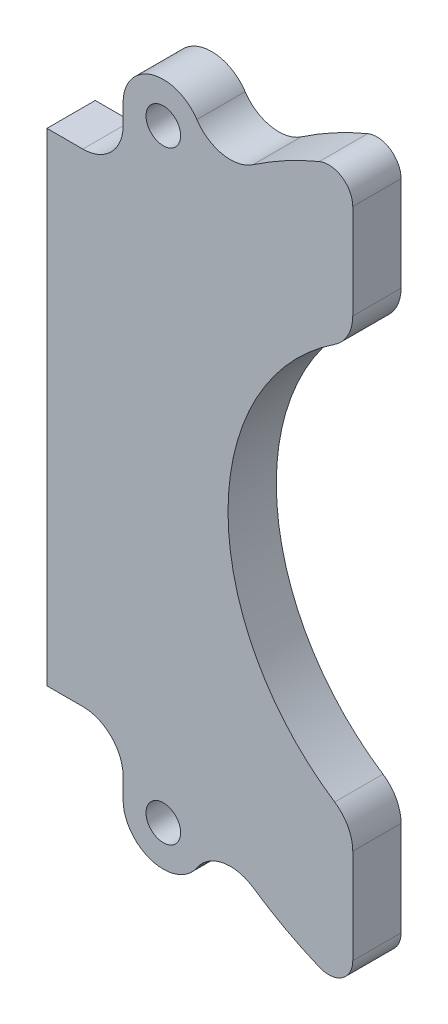
from build123d import *

# Parameters (mm, degrees)
SKETCH_1_R          = 2.15
EXTRUDE_1_DEPTH     = 6
CUT_EXTRUDE_START   = -10
CUT_EXTRUDE_1_DEPTH = 10
FILLET_1_R          = 5
FILLET_2_R          = 3


with BuildPart() as part:
    # 草图1 → 凸台-拉伸1 (new body)
    with BuildSketch(Plane.XY):
        with BuildLine():
            Line((-52, 30), (-52, 8.75))
            Line((-52, 8.75), (-52, -8.75))
            Line((-52, -8.75), (-52, -30))
            Line((-52, -30), (-47.54, -30))
            ThreePointArc((-47.54, -30), (-44.004466094, -31.464466094), (-42.54, -35))
            Line((-42.54, -35), (-42.54, -37.5))
            ThreePointArc((-42.54, -37.5), (-38.982425028, -42.287422066), (-33.372235985, -40.262198963))
            ThreePointArc((-33.372235985, -40.262198963), (-30.171244586, -38.118753147), (-26.396349665, -38.887436588))
            ThreePointArc((-26.396349665, -38.887436588), (0, -47), (26.396349665, -38.887436588))
            ThreePointArc((26.396349665, -38.887436588), (30.171244586, -38.118753147), (33.372235985, -40.262198963))
            ThreePointArc((33.372235985, -40.262198963), (38.674773042, -42.369526686), (42.499484755, -38.135225128))
            Line((42.499484755, -38.135225128), (46.619156699, -5.971116201))
            ThreePointArc((46.619156699, -5.971116201), (47, 0), (46.619156699, 5.971116201))
            Line((46.619156699, 5.971116201), (42.499484755, 38.135225128))
            ThreePointArc((42.499484755, 38.135225128), (38.674773042, 42.369526686), (33.372235985, 40.262198963))
            ThreePointArc((33.372235985, 40.262198963), (30.171244586, 38.118753147), (26.396349665, 38.887436588))
            ThreePointArc((26.396349665, 38.887436588), (0, 47), (-26.396349665, 38.887436588))
            ThreePointArc((-26.396349665, 38.887436588), (-30.171244586, 38.118753147), (-33.372235985, 40.262198963))
            ThreePointArc((-33.372235985, 40.262198963), (-38.982425028, 42.287422066), (-42.54, 37.5))
            Line((-42.54, 37.5), (-42.54, 35))
            ThreePointArc((-42.54, 35), (-44.004466094, 31.464466094), (-47.54, 30))
            Line((-47.54, 30), (-52, 30))
        make_face()
        with Locations((-37.54, -37.5)):
            Circle(SKETCH_1_R, mode=Mode.SUBTRACT)
        with Locations((37.54, -37.5)):
            Circle(SKETCH_1_R, mode=Mode.SUBTRACT)
        with Locations((-37.54, 37.5)):
            Circle(SKETCH_1_R, mode=Mode.SUBTRACT)
        with Locations((37.54, 37.5)):
            Circle(SKETCH_1_R, mode=Mode.SUBTRACT)
    extrude(amount=EXTRUDE_1_DEPTH)

    # 草图2 → 切除-拉伸1 (cut)
    with BuildSketch(Plane.XY.offset(6).offset(CUT_EXTRUDE_START)):
        with BuildLine():
            Line((-14, 44.866468548), (-14, 25.966324345))
            ThreePointArc((-14, 25.966324345), (-29.5, 0), (-14, -25.966324345))
            Line((-14, -25.966324345), (-14, -44.866468548))
            ThreePointArc((-14, -44.866468548), (6.881466199, -46.493498717), (26.396349665, -38.887436588))
            ThreePointArc((26.396349665, -38.887436588), (30.171244586, -38.118753147), (33.372235985, -40.262198963))
            ThreePointArc((33.372235985, -40.262198963), (38.674773042, -42.369526686), (42.499484755, -38.135225128))
            Line((42.499484755, -38.135225128), (46.619156699, -5.971116201))
            ThreePointArc((46.619156699, -5.971116201), (47, 0), (46.619156699, 5.971116201))
            Line((46.619156699, 5.971116201), (42.499484755, 38.135225128))
            ThreePointArc((42.499484755, 38.135225128), (38.674773042, 42.369526686), (33.372235985, 40.262198963))
            ThreePointArc((33.372235985, 40.262198963), (30.171244586, 38.118753147), (26.396349665, 38.887436588))
            ThreePointArc((26.396349665, 38.887436588), (6.881466199, 46.493498717), (-14, 44.866468548))
        make_face()
    extrude(amount=CUT_EXTRUDE_1_DEPTH, mode=Mode.SUBTRACT)

    # 圆角1
    fillet_1_edges = [part.edges().sort_by_distance(p)[0] for p in [
        (-14, -25.966324345, 3),
        (-14, 25.966324345, 3),
    ]]
    fillet(fillet_1_edges, radius=FILLET_1_R)

    # 圆角2
    fillet_2_edges = [part.edges().sort_by_distance(p)[0] for p in [
        (-14, 44.866468548, 3),
        (-14, -44.866468548, 3),
    ]]
    fillet(fillet_2_edges, radius=FILLET_2_R)


solid = part.part
